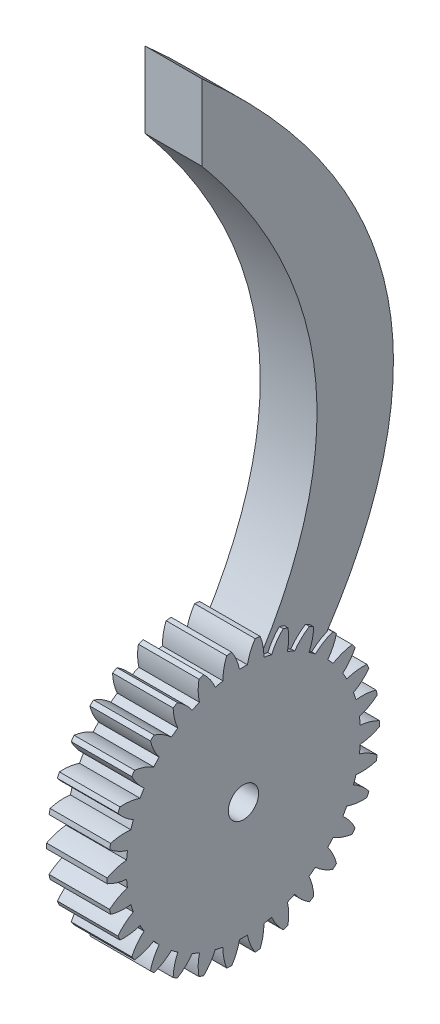
from build123d import *

# Parameters (mm, degrees)
BASPROSKE_W         = 8
BASPROSKE_H         = 18
TOOTHCUT_DEPTH      = 27.683328128
TEETHCUTS_COUNT     = 30
TEETHCUTS_ANGLE     = 348
BORSKE_R            = 2
BORE_DEPTH          = 50.0000508
BOSS_EXTRUDE1_DEPTH = 7.5


with BuildPart() as part:
    # BasProSke → Base-Revolve (revolve)
    with BuildSketch(Plane(origin=(0, 0, 0), x_dir=(1, 0, 0), z_dir=(0, 1, 0)), mode=Mode.PRIVATE) as base_revolve_sk:
        with Locations((4, 9)):
            Rectangle(BASPROSKE_W, BASPROSKE_H)
    revolve(base_revolve_sk.sketch.rotate(Axis((-10, 0, 0), (1, 0, 0)), 180), axis=Axis((-10, 0, 0), (1, 0, 0)))

    # TooCutSke → ToothCut (cut, through all)
    with BuildSketch(Plane(origin=(0, 0, 0), x_dir=(0, 0, -1), z_dir=(1, 0, 0))):
        with BuildLine():
            ThreePointArc((0.523521522, 15.458887906), (0, 15.46775), (-0.523521522, 15.458887906))
            ThreePointArc((-0.523521522, 15.458887906), (-0.919551256, 16.760900189), (-1.568701479, 17.957010353))
            ThreePointArc((-1.568701479, 17.957010353), (0, 18.0254), (1.568701479, 17.957010353))
            ThreePointArc((1.568701479, 17.957010353), (0.919551256, 16.760900189), (0.523521522, 15.458887906))
        make_face()
    toothcut = extrude(amount=TOOTHCUT_DEPTH, mode=Mode.SUBTRACT)

    # TeethCuts: ToothCut ×30 about axis
    teethcuts_axis = Axis((-10, 0, 0), (1, 0, 0))
    for i in range(1, TEETHCUTS_COUNT):
        add(toothcut.rotate(teethcuts_axis, i * TEETHCUTS_ANGLE / (TEETHCUTS_COUNT - 1)), mode=Mode.SUBTRACT)

    # BorSke → Bore (cut, symmetric)
    with BuildSketch(Plane(origin=(0, 0, 0), x_dir=(0, 0, -1), z_dir=(1, 0, 0))):
        with Locations(Location((0, 0, 0), (0, 0, 180))):
            Circle(BORSKE_R)
    extrude(amount=BORE_DEPTH, both=True, mode=Mode.SUBTRACT)

    # Sketch1 → Boss-Extrude1 (add)
    with BuildSketch(Plane.ZY):
        with BuildLine():
            Line((-5, 5), (5, 5))
            add(Edge.make_bspline(
                [(5, 5), (-25.441005716, 38.402255497), (5, 75)],
                knots=[0, 0, 0, 1, 1, 1], degree=2))
            Line((5, 75), (5, 85))
            add(Edge.make_bspline(
                [(-5, 5), (-40, 45), (5, 85)],
                knots=[0, 0, 0, 1, 1, 1], degree=2))
        make_face()
    extrude(amount=-BOSS_EXTRUDE1_DEPTH)


solid = part.part
